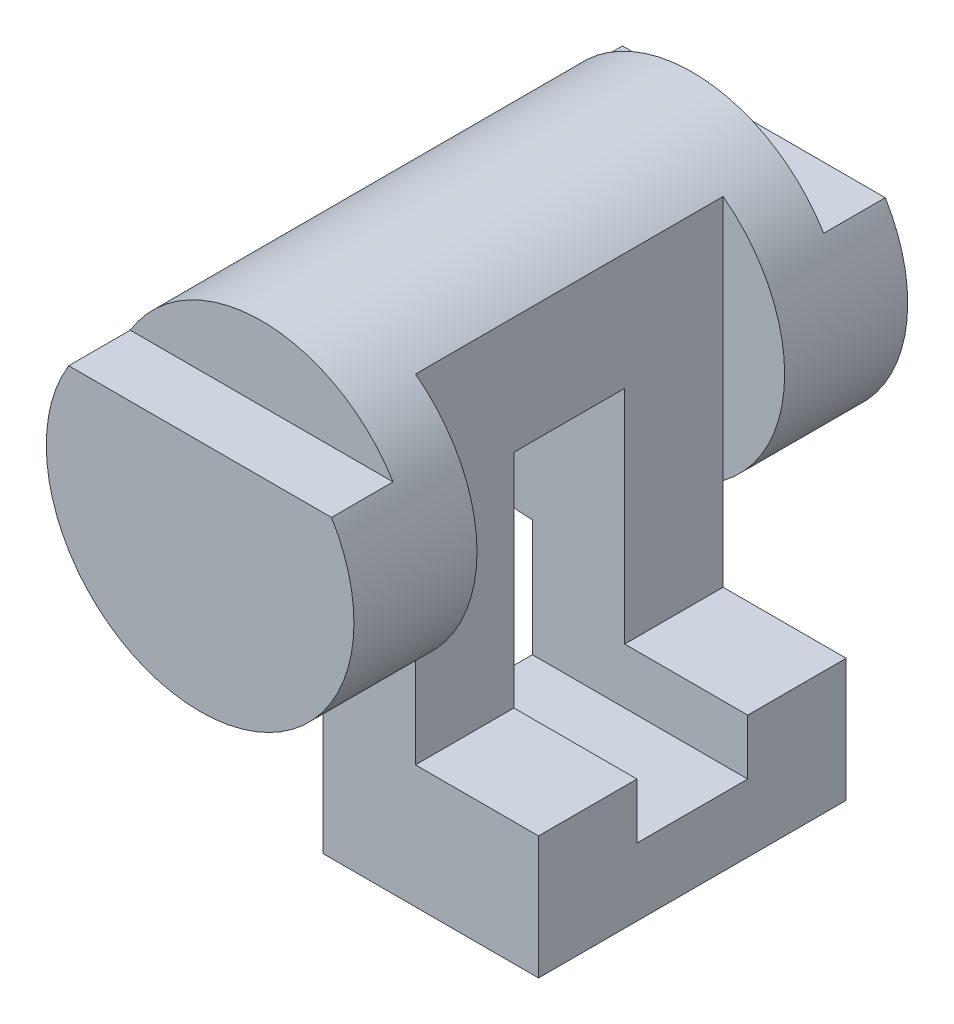
from build123d import *

# Parameters (mm, degrees)
CROQUIS1_R                 = 25
SALIENTE_EXTRUIR1_DEPTH    = 45
CORTAR_EXTRUIR1_DEPTH      = 10
CORTAR_EXTRUIR2_START      = -80
CORTAR_EXTRUIR2_DEPTH      = 10
CROQUIS3_W                 = 35
CROQUIS3_H                 = 50
SALIENTE_EXTRUIR2_DEPTH    = 68
CORTAR_EXTRUIR4_DEPTH      = 89.735562206
CORTAR_EXTRUIR4_DEPTH_BACK = 48
CROQUIS4_W                 = 20
CROQUIS4_H                 = 50
CROQUIS5_W                 = 18
CROQUIS5_H                 = 45
CORTAR_EXTRUIR5_DEPTH      = 94.005376189


with BuildPart() as part:
    # Croquis1 → Saliente-Extruir1 (new, symmetric)
    with BuildSketch(Plane.XY):
        with Locations(Location((0, 0, 0), (0, 0, 180))):
            Circle(CROQUIS1_R)
    extrude(amount=SALIENTE_EXTRUIR1_DEPTH, both=True)

    # Croquis2 → Cortar-Extruir1 (cut)
    with BuildSketch(Plane.XY.offset(45)):
        with BuildLine():
            Line((-21.354156504, 13), (21.354156504, 13))
            ThreePointArc((21.354156504, 13), (0, 25), (-21.354156504, 13))
        make_face()
    extrude(amount=-CORTAR_EXTRUIR1_DEPTH, mode=Mode.SUBTRACT)

    # Croquis2<2> → Cortar-Extruir2 (cut)
    with BuildSketch(Plane.XY.offset(45).offset(CORTAR_EXTRUIR2_START)):
        with BuildLine():
            Line((-21.354156504, 13), (21.354156504, 13))
            ThreePointArc((21.354156504, 13), (0, 25), (-21.354156504, 13))
        make_face()
    extrude(amount=-CORTAR_EXTRUIR2_DEPTH, mode=Mode.SUBTRACT)

    # Croquis3 → Saliente-Extruir2 (add)
    with BuildSketch(Plane(origin=(0, -55, 0), x_dir=(1, 0, 0), z_dir=(0, 1, 0))):
        with Locations((17.5, 0)):
            Rectangle(CROQUIS3_W, CROQUIS3_H)
    extrude(amount=SALIENTE_EXTRUIR2_DEPTH)

    # Croquis4 → Cortar-Extruir4 (cut, two sides: drawn at the far end of the back side and taken through both)
    with BuildSketch(Plane(origin=(0, 13, 0), x_dir=(1, 0, 0), z_dir=(0, 1, 0)).offset(-CORTAR_EXTRUIR4_DEPTH_BACK)):
        with Locations((25, 0)):
            Rectangle(CROQUIS4_W, CROQUIS4_H)
    extrude(amount=CORTAR_EXTRUIR4_DEPTH + CORTAR_EXTRUIR4_DEPTH_BACK, mode=Mode.SUBTRACT)

    # Croquis5 → Cortar-Extruir5 (cut, through all)
    with BuildSketch(Plane(origin=(35, 0, 0), x_dir=(0, 0, -1), z_dir=(1, 0, 0))):
        with Locations((0, -21.5)):
            Rectangle(CROQUIS5_W, CROQUIS5_H)
    extrude(amount=-CORTAR_EXTRUIR5_DEPTH, mode=Mode.SUBTRACT)


solid = part.part
